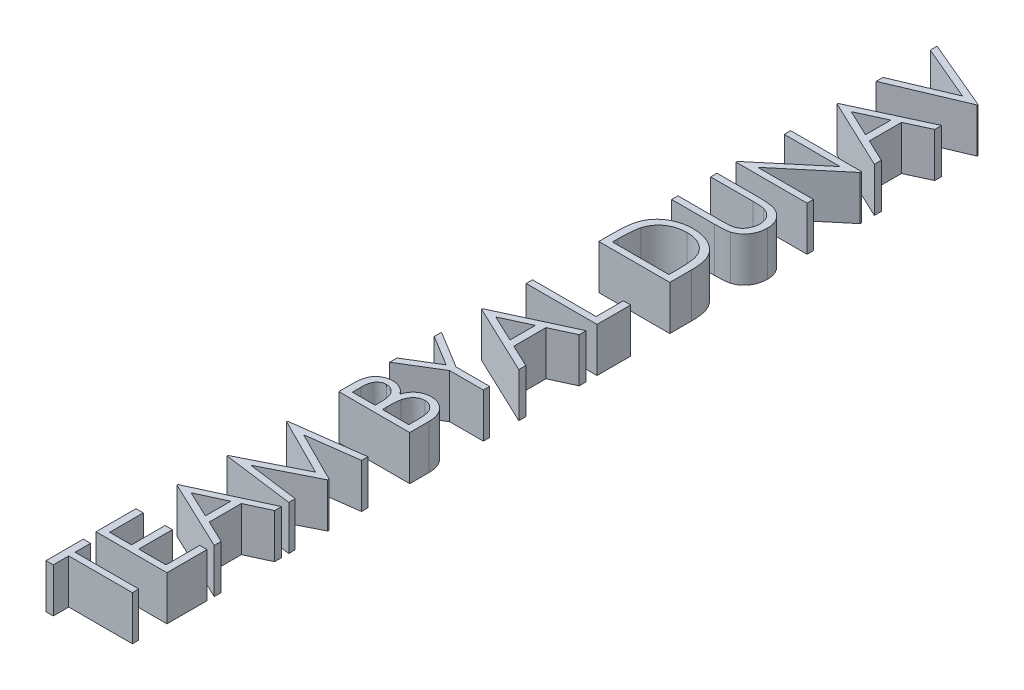
from build123d import *

# Parameters (mm, degrees)
BOSS_EXTRUDE2_DEPTH    = 5
BOSS_EXTRUDE2_2_DEPTH  = 5
BOSS_EXTRUDE2_3_DEPTH  = 5
BOSS_EXTRUDE2_4_DEPTH  = 5
BOSS_EXTRUDE2_5_DEPTH  = 5
BOSS_EXTRUDE2_6_DEPTH  = 5
BOSS_EXTRUDE2_7_DEPTH  = 5
BOSS_EXTRUDE2_8_DEPTH  = 5
BOSS_EXTRUDE2_9_DEPTH  = 5
BOSS_EXTRUDE2_10_DEPTH = 5
BOSS_EXTRUDE2_11_DEPTH = 5
BOSS_EXTRUDE2_12_DEPTH = 5
BOSS_EXTRUDE2_13_DEPTH = 5


with BuildPart() as part:
    # Sketch2 → Boss-Extrude2 (new body)
    with BuildSketch(Plane(origin=(0, 0, 0), x_dir=(1, 0, 0), z_dir=(0, 1, 0))):
        Polygon((-61.941537167, 36.949287264), (-61.941537167, 37.718518034), (-55.637049988, 40.3851847), (-61.941537167, 43.051851367), (-61.941537167, 43.821082136), (-53.941537167, 40.436466752), (-53.941537167, 40.333902649), align=None)
    extrude(amount=BOSS_EXTRUDE2_DEPTH)


with BuildPart() as body_2:
    # Sketch2 → Boss-Extrude2 2 (new body)
    with BuildSketch(Plane(origin=(0, 0, 0), x_dir=(1, 0, 0), z_dir=(0, 1, 0))):
        Polygon((-61.941537167, 32.641594957), (-53.941537167, 36.333902649), (-53.941537167, 35.553453931), (-56.505639731, 34.370761623), (-56.505639731, 30.744159059), (-53.941537167, 29.527812905), (-53.941537167, 28.744159059), (-61.941537167, 32.539030854), align=None)
        Polygon((-60.382242295, 32.582300085), (-57.326152552, 31.133582136), (-57.326152552, 33.992556495), align=None, mode=Mode.SUBTRACT)
    extrude(amount=BOSS_EXTRUDE2_2_DEPTH)


with BuildPart() as body_3:
    # Sketch2 → Boss-Extrude2 3 (new body)
    with BuildSketch(Plane(origin=(0, 0, 0), x_dir=(1, 0, 0), z_dir=(0, 1, 0))):
        Polygon((-53.941537167, 21.15441547), (-61.941537167, 21.15441547), (-61.941537167, 21.305056495), (-55.645062808, 26.590312905), (-61.941537167, 26.590312905), (-61.941537167, 27.308261623), (-53.941537167, 27.308261623), (-53.941537167, 27.144800085), (-60.223588449, 21.872364187), (-53.941537167, 21.872364187), align=None)
    extrude(amount=BOSS_EXTRUDE2_3_DEPTH)


with BuildPart() as body_4:
    # Sketch2 → Boss-Extrude2 4 (new body)
    with BuildSketch(Plane(origin=(0, 0, 0), x_dir=(1, 0, 0), z_dir=(0, 1, 0))):
        with BuildLine():
            Line((-61.941537167, 13.872364187), (-61.941537167, 14.590312905))
            Line((-61.941537167, 14.590312905), (-57.148267936, 14.590312905))
            add(Edge.make_bspline(
                [(-57.148267936, 14.590312905), (-57.080426255, 14.590206062), (-56.951684973, 14.590003308), (-56.768443143, 14.591357626), (-56.605534665, 14.595150468), (-56.462331585, 14.59754169), (-56.339491019, 14.602861309), (-56.236347452, 14.607199702), (-56.153389275, 14.612778117), (-56.10497573, 14.619482386), (-56.084165372, 14.622364187)],
                knots=[0, 0, 0, 0, 1.528628734, 2.90083645, 4.128790002, 5.200304208, 6.127813768, 6.898992206, 7.526736466, 8, 8, 8, 8], degree=3))
            add(Edge.make_bspline(
                [(-56.084165372, 14.622364187), (-56.008511415, 14.634063578), (-55.86246485, 14.656648725), (-55.654641605, 14.716653244), (-55.466996079, 14.796648934), (-55.295295654, 14.895888373), (-55.140631504, 15.021277833), (-55.001816562, 15.176952719), (-54.875669063, 15.360121992), (-54.76568658, 15.568161371), (-54.67433686, 15.789827694), (-54.605983825, 16.017174226), (-54.564151811, 16.245813183), (-54.559320779, 16.398905585), (-54.556921783, 16.47492829)],
                knots=[0, 0, 0, 0, 1.042777144, 2.01303441, 2.939567723, 3.817555404, 4.708046775, 5.641195415, 6.651191522, 7.732783915, 8.843021186, 9.914367358, 10.964315445, 12, 12, 12, 12], degree=3))
            add(Edge.make_bspline(
                [(-54.556921783, 16.47492829), (-54.559362691, 16.54019972), (-54.564230411, 16.67036559), (-54.594744894, 16.86366626), (-54.648655211, 17.052524973), (-54.722090903, 17.235458077), (-54.812397118, 17.409492602), (-54.920582496, 17.570166521), (-55.046597508, 17.71415644), (-55.186256923, 17.845555267), (-55.343636935, 17.959304242), (-55.51494073, 18.059876123), (-55.70473605, 18.139748685), (-55.838039316, 18.180187922), (-55.906280757, 18.200889829)],
                knots=[0, 0, 0, 0, 0.994718802, 1.98369237, 2.973235266, 3.981451368, 4.982709966, 5.955777334, 6.925228988, 7.892833478, 8.871333226, 9.877970804, 10.913677552, 12, 12, 12, 12], degree=3))
            add(Edge.make_bspline(
                [(-55.906280757, 18.200889829), (-55.93450607, 18.207747258), (-55.997403441, 18.223028374), (-56.10373782, 18.237307334), (-56.229199223, 18.252179392), (-56.374689081, 18.262498409), (-56.539719876, 18.272558341), (-56.725151321, 18.278576793), (-56.930310089, 18.281358583), (-57.073480744, 18.282187567), (-57.148267936, 18.282620598)],
                knots=[0, 0, 0, 0, 0.558680831, 1.244966039, 2.062412453, 2.990489873, 4.051219941, 5.244515665, 6.560634259, 8, 8, 8, 8], degree=3))
            Line((-57.148267936, 18.282620598), (-61.941537167, 18.282620598))
            Line((-61.941537167, 18.282620598), (-61.941537167, 19.000569316))
            Line((-61.941537167, 19.000569316), (-57.109806398, 19.000569316))
            add(Edge.make_bspline(
                [(-57.109806398, 19.000569316), (-57.022724406, 18.999988386), (-56.852778605, 18.998854668), (-56.603746687, 18.989025927), (-56.367512148, 18.973348727), (-56.144038392, 18.951218461), (-55.934141716, 18.921828928), (-55.736439579, 18.889448365), (-55.552021984, 18.847491149), (-55.378761228, 18.7988463), (-55.21299976, 18.744030201), (-55.055992047, 18.671786064), (-54.903126758, 18.590744467), (-54.756115576, 18.495403296), (-54.615892528, 18.38571743), (-54.478827775, 18.265889061), (-54.349006216, 18.131694583), (-54.224826711, 17.987097684), (-54.109339739, 17.833070561), (-54.008839893, 17.668618666), (-53.927005768, 17.494649921), (-53.854376369, 17.315283777), (-53.802753242, 17.126219827), (-53.76350182, 16.929813131), (-53.741386473, 16.724898702), (-53.738082198, 16.585554333), (-53.736408962, 16.514992393)],
                knots=[0, 0, 0, 0, 1.316707045, 2.569633854, 3.76780728, 4.896239288, 5.964314126, 6.972204208, 7.924543903, 8.822147865, 9.693191779, 10.560896119, 11.431827672, 12.307838457, 13.206132673, 14.12176355, 15.058527151, 16.026630406, 17.00238624, 17.966538933, 18.934743273, 19.906713913, 20.888635248, 21.892958714, 22.933025263, 24, 24, 24, 24], degree=3))
            add(Edge.make_bspline(
                [(-53.736408962, 16.514992393), (-53.738201468, 16.438033882), (-53.741718359, 16.287041559), (-53.761902251, 16.064562509), (-53.799822994, 15.851243906), (-53.848420276, 15.645003815), (-53.91435057, 15.447834746), (-53.995361317, 15.259794804), (-54.087847393, 15.078724896), (-54.197134273, 14.908704486), (-54.31630426, 14.748338843), (-54.447199423, 14.60260314), (-54.584834606, 14.467797864), (-54.734392463, 14.34986493), (-54.89281141, 14.244343724), (-55.060836564, 14.153559459), (-55.23824268, 14.075578948), (-55.361565256, 14.035336369), (-55.423908962, 14.014992393)],
                knots=[0, 0, 0, 0, 1.138939089, 2.234594419, 3.301501784, 4.342532435, 5.367382236, 6.373123747, 7.370098489, 8.372230273, 9.360297234, 10.323289009, 11.268038109, 12.20748145, 13.137029304, 14.081414587, 15.030090602, 16, 16, 16, 16], degree=3))
            add(Edge.make_bspline(
                [(-55.423908962, 14.014992393), (-55.466497704, 14.003158888), (-55.558873633, 13.977491754), (-55.711757035, 13.950005359), (-55.887791133, 13.926898887), (-56.086987975, 13.905171896), (-56.309501955, 13.892351421), (-56.55523662, 13.881111561), (-56.824489104, 13.872285004), (-57.012042283, 13.872337055), (-57.109806398, 13.872364187)],
                knots=[0, 0, 0, 0, 0.625038921, 1.35572334, 2.194682327, 3.136881307, 4.189498639, 5.346923369, 6.617055217, 8, 8, 8, 8], degree=3))
            Line((-57.109806398, 13.872364187), (-61.941537167, 13.872364187))
        make_face()
    extrude(amount=BOSS_EXTRUDE2_4_DEPTH)


with BuildPart() as body_5:
    # Sketch2 → Boss-Extrude2 5 (new body)
    with BuildSketch(Plane(origin=(0, 0, 0), x_dir=(1, 0, 0), z_dir=(0, 1, 0))):
        with BuildLine():
            Line((-53.941537167, 5.667235982), (-61.941537167, 5.667235982))
            Line((-61.941537167, 5.667235982), (-61.941537167, 7.282620598))
            add(Edge.make_bspline(
                [(-61.941537167, 7.282620598), (-61.940525579, 7.423121142), (-61.938571195, 7.694567463), (-61.926179444, 8.086824486), (-61.904258379, 8.4497588), (-61.872328033, 8.782176764), (-61.833121099, 9.084990962), (-61.783977318, 9.357353495), (-61.725947214, 9.600672679), (-61.676471899, 9.750317115), (-61.653075629, 9.821082136)],
                knots=[0, 0, 0, 0, 1.314313732, 2.53924729, 3.670748893, 4.714932338, 5.66265055, 6.526160246, 7.303039223, 8, 8, 8, 8], degree=3))
            add(Edge.make_bspline(
                [(-61.653075629, 9.821082136), (-61.617816428, 9.913649876), (-61.548097589, 10.096686228), (-61.416380878, 10.357152922), (-61.267753108, 10.603188791), (-61.09879394, 10.83283222), (-60.911709699, 11.046659409), (-60.707836912, 11.247097232), (-60.482646631, 11.429203894), (-60.240147112, 11.595815706), (-59.983445455, 11.746078418), (-59.712962071, 11.876679566), (-59.430089305, 11.985146555), (-59.135608733, 12.075188019), (-58.82887422, 12.146151405), (-58.509528222, 12.194567233), (-58.178832937, 12.226500929), (-57.954434162, 12.229710188), (-57.840575629, 12.231338546)],
                knots=[0, 0, 0, 0, 0.984741985, 1.947153288, 2.898543998, 3.841229145, 4.778974371, 5.722123648, 6.681464302, 7.655713756, 8.646344578, 9.637374342, 10.639946623, 11.656849581, 12.698333139, 13.76849723, 14.867749466, 16, 16, 16, 16], degree=3))
            add(Edge.make_bspline(
                [(-57.840575629, 12.231338546), (-57.741692799, 12.229900905), (-57.546833854, 12.227067884), (-57.259654652, 12.201629463), (-56.980995107, 12.164654959), (-56.712181907, 12.10741129), (-56.450860888, 12.037919064), (-56.199813479, 11.948860957), (-55.956750269, 11.846826663), (-55.724908175, 11.7278934), (-55.50540064, 11.597146878), (-55.298320482, 11.457709634), (-55.108262878, 11.306419341), (-54.930247457, 11.147753731), (-54.769029701, 10.977886608), (-54.621670826, 10.798886077), (-54.49063794, 10.610056495), (-54.373871987, 10.410228953), (-54.269451426, 10.196734703), (-54.18235215, 9.962858272), (-54.106915285, 9.709707484), (-54.046905255, 9.435838684), (-53.998506735, 9.14222868), (-53.966282815, 8.828062989), (-53.944428909, 8.493935342), (-53.942519798, 8.264496229), (-53.941537167, 8.146402649)],
                knots=[0, 0, 0, 0, 1.106010661, 2.179509527, 3.223302912, 4.248870533, 5.252098245, 6.246278179, 7.226402005, 8.199283979, 9.158616973, 10.083547221, 10.989831858, 11.874256832, 12.749262829, 13.607058236, 14.46581075, 15.317568432, 16.194266721, 17.121067875, 18.106207572, 19.147242834, 20.255495536, 21.43354536, 22.679031616, 24, 24, 24, 24], degree=3))
            Line((-53.941537167, 8.146402649), (-53.941537167, 5.667235982))
        make_face()
        with BuildLine():
            Line((-54.762049988, 6.3851847), (-54.762049988, 7.303453931))
            add(Edge.make_bspline(
                [(-54.762049988, 7.303453931), (-54.762617065, 7.435404493), (-54.763707763, 7.689193746), (-54.773278513, 8.054126312), (-54.788917227, 8.387564932), (-54.810803119, 8.689556953), (-54.839759954, 8.959931866), (-54.872045446, 9.199254723), (-54.91226819, 9.406741028), (-54.948727526, 9.532294027), (-54.965575629, 9.590312905)],
                knots=[0, 0, 0, 0, 1.375205317, 2.645023457, 3.804390687, 4.853969522, 5.800190428, 6.637939096, 7.370582563, 8, 8, 8, 8], degree=3))
            add(Edge.make_bspline(
                [(-54.965575629, 9.590312905), (-54.991293471, 9.663337741), (-55.042114886, 9.807643214), (-55.134818181, 10.015371299), (-55.244628371, 10.209102), (-55.366691646, 10.39220915), (-55.50530759, 10.56210417), (-55.657482956, 10.720767127), (-55.823912997, 10.868003769), (-56.004327841, 11.001546254), (-56.196771104, 11.122505012), (-56.40158314, 11.226343031), (-56.615884598, 11.316772343), (-56.841410372, 11.388375982), (-57.076507477, 11.444832313), (-57.322394994, 11.484405046), (-57.578855338, 11.508972396), (-57.753446882, 11.511901296), (-57.842178193, 11.513389829)],
                knots=[0, 0, 0, 0, 0.998590647, 1.973329978, 2.929871262, 3.868367705, 4.809062953, 5.754642869, 6.701828697, 7.672172887, 8.647399344, 9.630604387, 10.631475358, 11.644913558, 12.679592956, 13.747988925, 14.855477812, 16, 16, 16, 16], degree=3))
            add(Edge.make_bspline(
                [(-57.842178193, 11.513389829), (-57.935740434, 11.5122166), (-58.119544284, 11.509911783), (-58.389237301, 11.480941931), (-58.648621645, 11.438606947), (-58.897714663, 11.377387093), (-59.137002326, 11.299373655), (-59.365161206, 11.202014474), (-59.584600906, 11.090776487), (-59.790256599, 10.958426003), (-59.984755134, 10.813476075), (-60.162937799, 10.652612351), (-60.325210485, 10.478390549), (-60.474100343, 10.292710893), (-60.603617316, 10.09034038), (-60.719472587, 9.87604623), (-60.817794624, 9.646684696), (-60.870089168, 9.48711282), (-60.896665372, 9.406018034)],
                knots=[0, 0, 0, 0, 1.122418816, 2.205001699, 3.251619955, 4.274784885, 5.280384055, 6.268708349, 7.249350384, 8.229342522, 9.199999885, 10.157847722, 11.105861043, 12.055065948, 13.010012805, 13.98527497, 14.976112212, 16, 16, 16, 16], degree=3))
            add(Edge.make_bspline(
                [(-60.896665372, 9.406018034), (-60.915217207, 9.338929699), (-60.954663499, 9.196281493), (-60.997692922, 8.963505575), (-61.035646063, 8.701528091), (-61.067778724, 8.409185917), (-61.090835458, 8.086812296), (-61.10814132, 7.734159295), (-61.119813623, 7.351074484), (-61.120610668, 7.085514407), (-61.121024347, 6.9476847)],
                knots=[0, 0, 0, 0, 0.674548936, 1.434276114, 2.292660221, 3.240891867, 4.284742987, 5.42552168, 6.663806718, 8, 8, 8, 8], degree=3))
            Line((-61.121024347, 6.9476847), (-61.121024347, 6.3851847))
            Line((-61.121024347, 6.3851847), (-54.762049988, 6.3851847))
        make_face(mode=Mode.SUBTRACT)
    extrude(amount=BOSS_EXTRUDE2_5_DEPTH)


with BuildPart() as body_6:
    # Sketch2 → Boss-Extrude2 6 (new body)
    with BuildSketch(Plane(origin=(0, 0, 0), x_dir=(1, 0, 0), z_dir=(0, 1, 0))):
        Polygon((-61.941537167, -2.537892223), (-61.941537167, -1.819943505), (-54.762049988, -1.819943505), (-54.762049988, 1.256979572), (-53.941537167, 1.256979572), (-53.941537167, -2.537892223), align=None)
    extrude(amount=BOSS_EXTRUDE2_6_DEPTH)


with BuildPart() as body_7:
    # Sketch2 → Boss-Extrude2 7 (new body)
    with BuildSketch(Plane(origin=(0, 0, 0), x_dir=(1, 0, 0), z_dir=(0, 1, 0))):
        Polygon((-61.941537167, -7.460969146), (-53.941537167, -3.768661454), (-53.941537167, -4.549110171), (-56.505639731, -5.731802479), (-56.505639731, -9.358405043), (-53.941537167, -10.574751197), (-53.941537167, -11.358405043), (-61.941537167, -7.563533248), align=None)
        Polygon((-60.382242295, -7.520264018), (-57.326152552, -8.968981966), (-57.326152552, -6.110007607), align=None, mode=Mode.SUBTRACT)
    extrude(amount=BOSS_EXTRUDE2_7_DEPTH)


with BuildPart() as body_8:
    # Sketch2 → Boss-Extrude2 8 (new body)
    with BuildSketch(Plane(origin=(0, 0, 0), x_dir=(1, 0, 0), z_dir=(0, 1, 0))):
        Polygon((-61.941537167, -17.922507607), (-61.941537167, -17.100392223), (-58.504037167, -14.99782812), (-61.941537167, -12.898469146), (-61.941537167, -12.076353761), (-57.744421783, -14.640456325), (-53.941537167, -14.640456325), (-53.941537167, -15.358405043), (-57.744421783, -15.358405043), align=None)
    extrude(amount=BOSS_EXTRUDE2_8_DEPTH)


with BuildPart() as body_9:
    # Sketch2 → Boss-Extrude2 9 (new body)
    with BuildSketch(Plane(origin=(0, 0, 0), x_dir=(1, 0, 0), z_dir=(0, 1, 0))):
        with BuildLine():
            Line((-61.941537167, -23.666097351), (-61.941537167, -22.105199915))
            add(Edge.make_bspline(
                [(-61.941537167, -22.105199915), (-61.941141776, -22.02879076), (-61.94037541, -21.880690801), (-61.928213734, -21.665348453), (-61.912045937, -21.463580156), (-61.884925327, -21.275742459), (-61.856804831, -21.100613131), (-61.815530676, -20.939970102), (-61.769941868, -20.792467787), (-61.699797299, -20.615347698), (-61.5908619, -20.414380688), (-61.429300351, -20.198378755), (-61.2356011, -20.010616695), (-61.014865525, -19.850963289), (-60.772031379, -19.722838034), (-60.512323317, -19.631317726), (-60.240110616, -19.572521595), (-60.053483641, -19.566550795), (-59.959165372, -19.563533248)],
                knots=[0, 0, 0, 0, 1.00128172, 1.940733171, 2.826250472, 3.653024905, 4.427672124, 5.149348099, 5.824709082, 6.450061444, 7.643590664, 8.808605388, 9.972104426, 11.165284501, 12.367876273, 13.557044126, 14.765369432, 16, 16, 16, 16], degree=3))
            add(Edge.make_bspline(
                [(-59.959165372, -19.563533248), (-59.870820558, -19.566046644), (-59.697214667, -19.570985704), (-59.443733889, -19.617639351), (-59.202688486, -19.691685356), (-58.974284759, -19.794019921), (-58.762774461, -19.925872283), (-58.568812794, -20.083849946), (-58.399730443, -20.273658846), (-58.305239442, -20.415940236), (-58.257242295, -20.488212736)],
                knots=[0, 0, 0, 0, 1.044641374, 2.052818814, 3.038628718, 4.023282556, 5.005660861, 5.98021751, 6.974042014, 8, 8, 8, 8], degree=3))
            add(Edge.make_bspline(
                [(-58.257242295, -20.488212736), (-58.222339571, -20.397340534), (-58.155562014, -20.223479501), (-58.037684673, -19.984083336), (-57.909010288, -19.778580509), (-57.770662342, -19.602956626), (-57.619338619, -19.453546163), (-57.453809683, -19.324148062), (-57.274211046, -19.212280882), (-57.08120279, -19.117082686), (-56.876421133, -19.042303316), (-56.662367282, -18.987341515), (-56.439861811, -18.954830415), (-56.288865143, -18.950395403), (-56.212370501, -18.948148633)],
                knots=[0, 0, 0, 0, 1.272586185, 2.434772614, 3.483318042, 4.437947805, 5.351807173, 6.25737843, 7.180033415, 8.1141739, 9.066731021, 10.025721652, 10.999834114, 12, 12, 12, 12], degree=3))
            add(Edge.make_bspline(
                [(-56.212370501, -18.948148633), (-56.134274475, -18.950380936), (-55.980618357, -18.954773054), (-55.754896874, -18.987191389), (-55.539166028, -19.042043729), (-55.332129847, -19.117729178), (-55.134222412, -19.215830118), (-54.946160677, -19.33694122), (-54.767553381, -19.479362326), (-54.598085304, -19.640321198), (-54.443016687, -19.819697267), (-54.309709971, -20.017381242), (-54.195085194, -20.227957542), (-54.101761787, -20.454118187), (-54.029762842, -20.695285834), (-53.97959938, -20.951326285), (-53.9457426, -21.221817879), (-53.942962764, -21.407441526), (-53.941537167, -21.502635813)],
                knots=[0, 0, 0, 0, 0.978680899, 1.925582087, 2.851223405, 3.764209995, 4.683484765, 5.614004905, 6.562443559, 7.542772147, 8.539900013, 9.527881485, 10.525548727, 11.540192123, 12.58875426, 13.674701727, 14.807505862, 16, 16, 16, 16], degree=3))
            Line((-53.941537167, -21.502635813), (-53.941537167, -23.666097351))
            Line((-53.941537167, -23.666097351), (-61.941537167, -23.666097351))
        make_face()
        with BuildLine():
            Line((-61.121024347, -22.948148633), (-58.556921783, -22.948148633))
            Line((-58.556921783, -22.948148633), (-58.556921783, -22.465776838))
            add(Edge.make_bspline(
                [(-58.556921783, -22.465776838), (-58.557835892, -22.395265306), (-58.559602138, -22.259022656), (-58.564661608, -22.061720037), (-58.578828558, -21.878577131), (-58.592991463, -21.709910108), (-58.616019026, -21.555984445), (-58.643429807, -21.417141582), (-58.672418612, -21.291201127), (-58.721723219, -21.14597128), (-58.794566649, -20.981210043), (-58.907723459, -20.805682655), (-59.04239435, -20.650222505), (-59.199239421, -20.520519414), (-59.370071283, -20.413430147), (-59.553390191, -20.338410748), (-59.745507091, -20.288397548), (-59.877650261, -20.283810774), (-59.944742295, -20.281481966)],
                knots=[0, 0, 0, 0, 1.156917035, 2.235399477, 3.236897345, 4.169954739, 5.01148057, 5.788325709, 6.491867502, 7.129259015, 8.302032419, 9.437271567, 10.542795419, 11.662606952, 12.764338259, 13.836858145, 14.901724648, 16, 16, 16, 16], degree=3))
            add(Edge.make_bspline(
                [(-59.944742295, -20.281481966), (-59.98914988, -20.282664392), (-60.076260205, -20.284983848), (-60.203659503, -20.304670301), (-60.323368115, -20.336567581), (-60.436534941, -20.379765097), (-60.540347515, -20.438779314), (-60.63976627, -20.507184545), (-60.728836509, -20.591640514), (-60.81184642, -20.687083258), (-60.886140012, -20.796286781), (-60.947680739, -20.921603873), (-61.003457085, -21.059794897), (-61.044746655, -21.214609052), (-61.081054359, -21.382838535), (-61.103866732, -21.566761235), (-61.118546711, -21.765211673), (-61.120180047, -21.902712902), (-61.121024347, -21.973789659)],
                knots=[0, 0, 0, 0, 0.911708768, 1.788416306, 2.640049961, 3.452993646, 4.268229297, 5.087074648, 5.92553149, 6.781184137, 7.681934069, 8.628939405, 9.643570426, 10.73771997, 11.914765019, 13.176320755, 14.540391495, 16, 16, 16, 16], degree=3))
            Line((-61.121024347, -21.973789659), (-61.121024347, -22.948148633))
        make_face(mode=Mode.SUBTRACT)
        with BuildLine():
            Line((-57.736408962, -22.948148633), (-54.762049988, -22.948148633))
            Line((-54.762049988, -22.948148633), (-54.762049988, -21.925712736))
            add(Edge.make_bspline(
                [(-54.762049988, -21.925712736), (-54.763014342, -21.852534274), (-54.764873007, -21.711492435), (-54.769231962, -21.507691886), (-54.785721229, -21.319293199), (-54.800932503, -21.145702045), (-54.826943129, -20.987379135), (-54.851490396, -20.843106642), (-54.887929062, -20.715252896), (-54.938009721, -20.565634434), (-55.018182638, -20.398395575), (-55.135314513, -20.215633605), (-55.27987333, -20.056268), (-55.444281607, -19.919467505), (-55.62255035, -19.806573796), (-55.812349036, -19.72556188), (-56.009986441, -19.675218187), (-56.144773341, -19.66914375), (-56.212370501, -19.666097351)],
                knots=[0, 0, 0, 0, 1.160376723, 2.23647316, 3.230273494, 4.158083346, 4.997711197, 5.773399541, 6.476071462, 7.102777513, 8.27340052, 9.405620712, 10.53304798, 11.669441455, 12.787990954, 13.865552736, 14.929550474, 16, 16, 16, 16], degree=3))
            add(Edge.make_bspline(
                [(-56.212370501, -19.666097351), (-56.254641904, -19.666726514), (-56.338502868, -19.667974691), (-56.461725753, -19.686884274), (-56.581148215, -19.714240446), (-56.697267907, -19.750269313), (-56.808132427, -19.800635727), (-56.914166944, -19.862380728), (-57.017507488, -19.933058853), (-57.149844006, -20.042101831), (-57.300424607, -20.203021448), (-57.446031243, -20.431706182), (-57.565354471, -20.690293132), (-57.615799224, -20.878282021), (-57.64185768, -20.975392223)],
                knots=[0, 0, 0, 0, 0.723302347, 1.434937762, 2.129609326, 2.821140842, 3.513216847, 4.209993937, 4.920569932, 5.655069131, 7.14393391, 8.6716197, 10.280644748, 12, 12, 12, 12], degree=3))
            add(Edge.make_bspline(
                [(-57.64185768, -20.975392223), (-57.649755015, -21.01431587), (-57.666878066, -21.098710367), (-57.684952816, -21.236327694), (-57.70105581, -21.393438251), (-57.712967028, -21.570404828), (-57.725279127, -21.767451322), (-57.73006729, -21.984998565), (-57.735779884, -22.222158141), (-57.736193905, -22.386712135), (-57.736408962, -22.472187095)],
                knots=[0, 0, 0, 0, 0.634451884, 1.375622551, 2.216452059, 3.157844607, 4.20941857, 5.370758133, 6.634282058, 8, 8, 8, 8], degree=3))
            Line((-57.736408962, -22.472187095), (-57.736408962, -22.948148633))
        make_face(mode=Mode.SUBTRACT)
    extrude(amount=BOSS_EXTRUDE2_9_DEPTH)


with BuildPart() as body_10:
    # Sketch2 → Boss-Extrude2 10 (new body)
    with BuildSketch(Plane(origin=(0, 0, 0), x_dir=(1, 0, 0), z_dir=(0, 1, 0))):
        Polygon((-53.941537167, -37.307122992), (-61.941537167, -36.251033248), (-61.941537167, -36.148469146), (-55.377434603, -32.84558453), (-61.941537167, -29.550712736), (-61.941537167, -29.446546069), (-53.941537167, -28.384046069), (-53.941537167, -29.105199915), (-59.697947424, -29.871225556), (-53.941537167, -32.759046069), (-53.941537167, -32.920905043), (-59.710767936, -35.819943505), (-53.941537167, -36.584366582), align=None)
    extrude(amount=BOSS_EXTRUDE2_10_DEPTH)


with BuildPart() as body_11:
    # Sketch2 → Boss-Extrude2 11 (new body)
    with BuildSketch(Plane(origin=(0, 0, 0), x_dir=(1, 0, 0), z_dir=(0, 1, 0))):
        Polygon((-61.941537167, -41.819943505), (-53.941537167, -38.127635813), (-53.941537167, -38.90808453), (-56.505639731, -40.090776838), (-56.505639731, -43.717379402), (-53.941537167, -44.933725556), (-53.941537167, -45.717379402), (-61.941537167, -41.922507607), align=None)
        Polygon((-60.382242295, -41.879238377), (-57.326152552, -43.327956325), (-57.326152552, -40.468981966), align=None, mode=Mode.SUBTRACT)
    extrude(amount=BOSS_EXTRUDE2_11_DEPTH)


with BuildPart() as body_12:
    # Sketch2 → Boss-Extrude2 12 (new body)
    with BuildSketch(Plane(origin=(0, 0, 0), x_dir=(1, 0, 0), z_dir=(0, 1, 0))):
        Polygon((-61.941537167, -51.050712736), (-61.941537167, -46.537892223), (-61.121024347, -46.537892223), (-61.121024347, -50.332764018), (-58.659485885, -50.332764018), (-58.659485885, -46.537892223), (-57.838973065, -46.537892223), (-57.838973065, -50.332764018), (-54.762049988, -50.332764018), (-54.762049988, -46.537892223), (-53.941537167, -46.537892223), (-53.941537167, -51.050712736), align=None)
    extrude(amount=BOSS_EXTRUDE2_12_DEPTH)


with BuildPart() as body_13:
    # Sketch2 → Boss-Extrude2 13 (new body)
    with BuildSketch(Plane(origin=(0, 0, 0), x_dir=(1, 0, 0), z_dir=(0, 1, 0))):
        Polygon((-61.121024347, -56.691738377), (-61.941537167, -56.691738377), (-61.941537167, -52.486610171), (-61.121024347, -52.486610171), (-61.121024347, -54.230199915), (-53.941537167, -54.230199915), (-53.941537167, -54.948148633), (-61.121024347, -54.948148633), align=None)
    extrude(amount=BOSS_EXTRUDE2_13_DEPTH)


solid = Compound([part.part, body_2.part, body_3.part, body_4.part, body_5.part, body_6.part, body_7.part, body_8.part, body_9.part, body_10.part, body_11.part, body_12.part, body_13.part])
